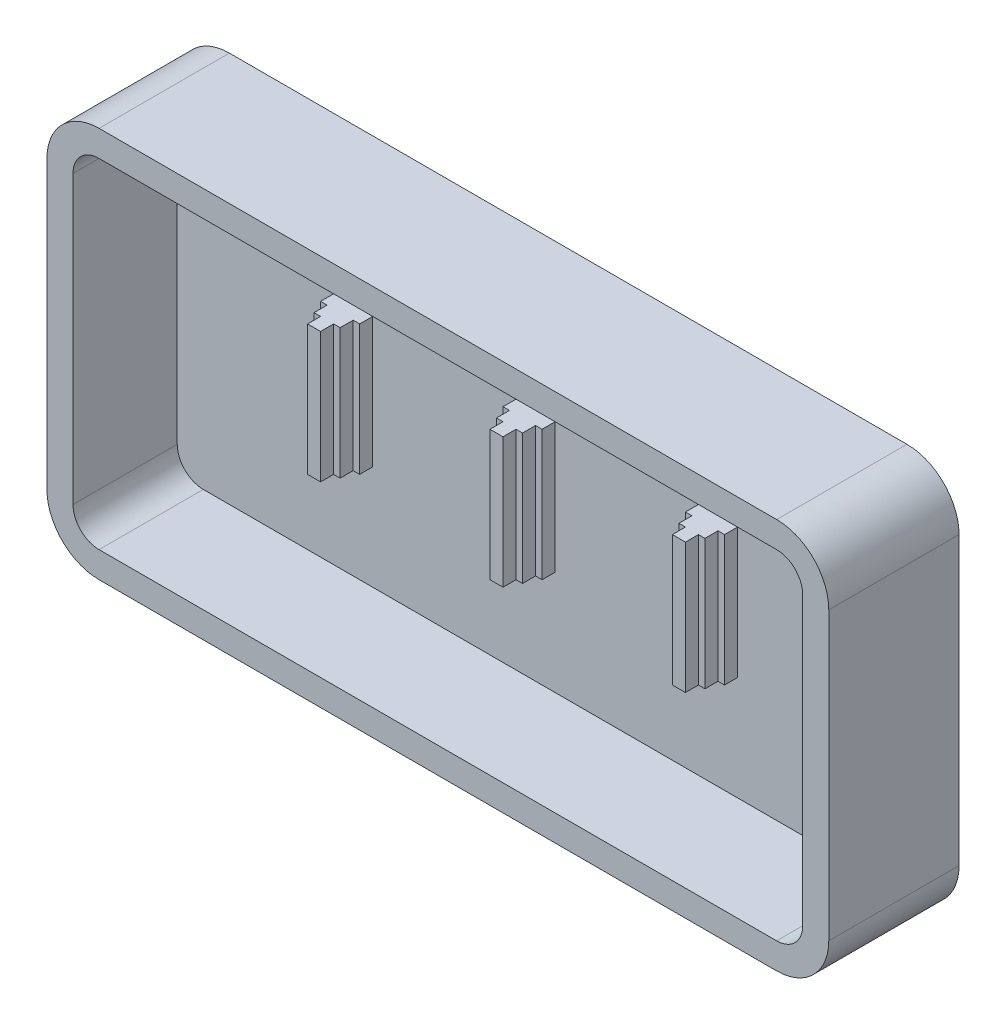
from build123d import *

# Parameters (mm, degrees)
SKETCH1_W           = 60
SKETCH1_H           = 30
BOSS_EXTRUDE1_DEPTH = 10
FILLET1_R           = 4
SHELL1_T            = -2
SKETCH29_W          = 3
SKETCH29_H          = 10
BOSS_EXTRUDE2_DEPTH = 1
SKETCH30_W          = 2
SKETCH30_H          = 10
BOSS_EXTRUDE3_DEPTH = 1
SKETCH31_W          = 1
SKETCH31_H          = 10
BOSS_EXTRUDE4_DEPTH = 1


with BuildPart() as part:
    # Sketch1 → Boss-Extrude1 (new body)
    with BuildSketch(Plane.XY):
        with Locations((8.508287293, 1.740331492)):
            Rectangle(SKETCH1_W, SKETCH1_H)
    extrude(amount=BOSS_EXTRUDE1_DEPTH)

    # Fillet1
    fillet1_edges = [part.edges().sort_by_distance(p)[0] for p in [
        (-21.491712707, 16.740331492, 5),
        (38.508287293, 16.740331492, 5),
        (38.508287293, -13.259668508, 5),
        (-21.491712707, -13.259668508, 5),
    ]]
    fillet(fillet1_edges, radius=FILLET1_R)

    # Shell1
    shell1_openings = [part.faces().sort_by_distance(p)[0] for p in [
        (8.508287293, 1.740331492, 10),
    ]]
    offset(amount=SHELL1_T, openings=shell1_openings, kind=Kind.INTERSECTION)

    # Sketch29 → Boss-Extrude2 (add)
    with BuildSketch(Plane.XY.offset(2)):
        with Locations((22.008287293, 1.740331492)):
            Rectangle(SKETCH29_W, SKETCH29_H)
        with Locations((8.008287293, 1.740331492)):
            Rectangle(SKETCH29_W, SKETCH29_H)
        with Locations((-5.991712707, 1.740331492)):
            Rectangle(SKETCH29_W, SKETCH29_H)
    extrude(amount=BOSS_EXTRUDE2_DEPTH)

    # Sketch30 → Boss-Extrude3 (add)
    with BuildSketch(Plane.XY.offset(3)):
        with Locations((22.008287293, 1.740331492)):
            Rectangle(SKETCH30_W, SKETCH30_H)
        with Locations((8.008287293, 1.740331492)):
            Rectangle(SKETCH30_W, SKETCH30_H)
        with Locations((-5.991712707, 1.740331492)):
            Rectangle(SKETCH30_W, SKETCH30_H)
    extrude(amount=BOSS_EXTRUDE3_DEPTH)

    # Sketch31 → Boss-Extrude4 (add)
    with BuildSketch(Plane.XY.offset(4)):
        with Locations((22.008287293, 1.740331492)):
            Rectangle(SKETCH31_W, SKETCH31_H)
        with Locations((8.008287293, 1.740331492)):
            Rectangle(SKETCH31_W, SKETCH31_H)
        with Locations((-5.991712707, 1.740331492)):
            Rectangle(SKETCH31_W, SKETCH31_H)
    extrude(amount=BOSS_EXTRUDE4_DEPTH)


solid = part.part
